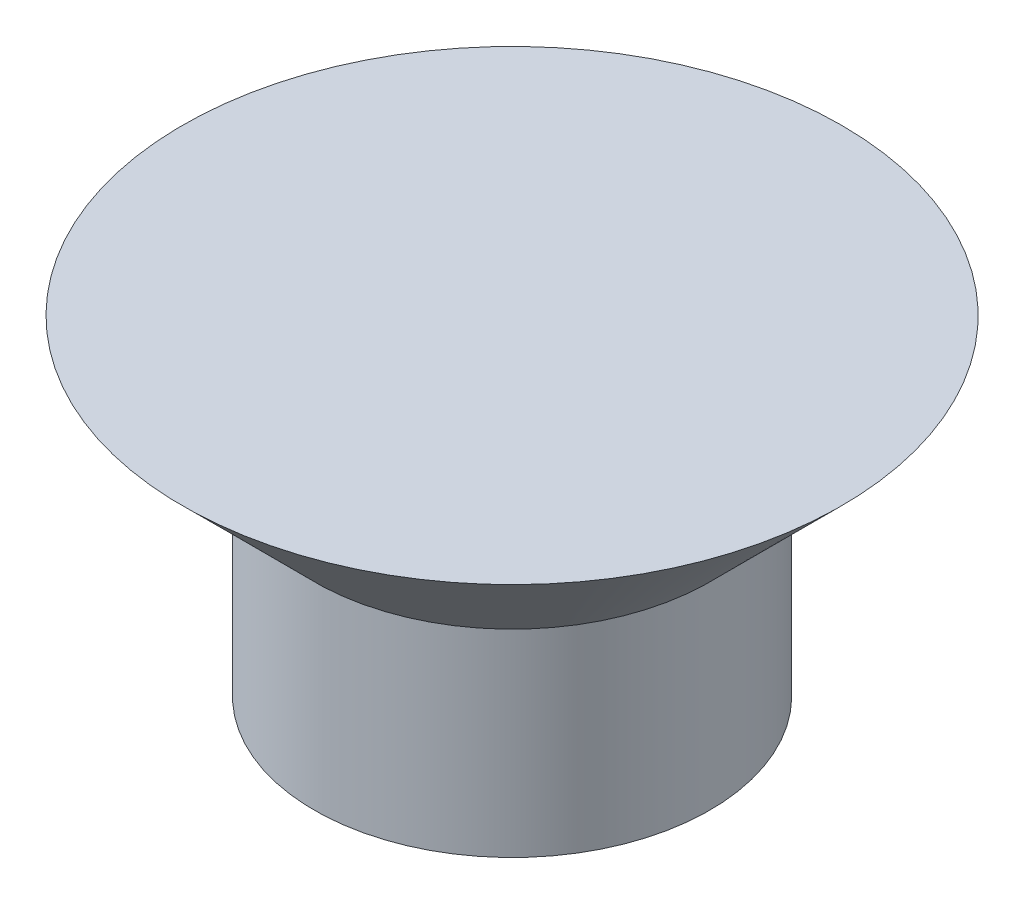
from build123d import *


with BuildPart() as part:
    # Sketch1 → Revolve1 (revolve)
    with BuildSketch(Plane.XY, mode=Mode.PRIVATE) as revolve1_sk:
        Polygon((0, 0), (0, 2.5), (2.5, 2.5), (1.5, 1.5), (1.5, 0), align=None)
    revolve(revolve1_sk.sketch.rotate(Axis((0, 0, 0), (0, 1, 0)), 90), axis=Axis((0, 0, 0), (0, 1, 0)))


solid = part.part
